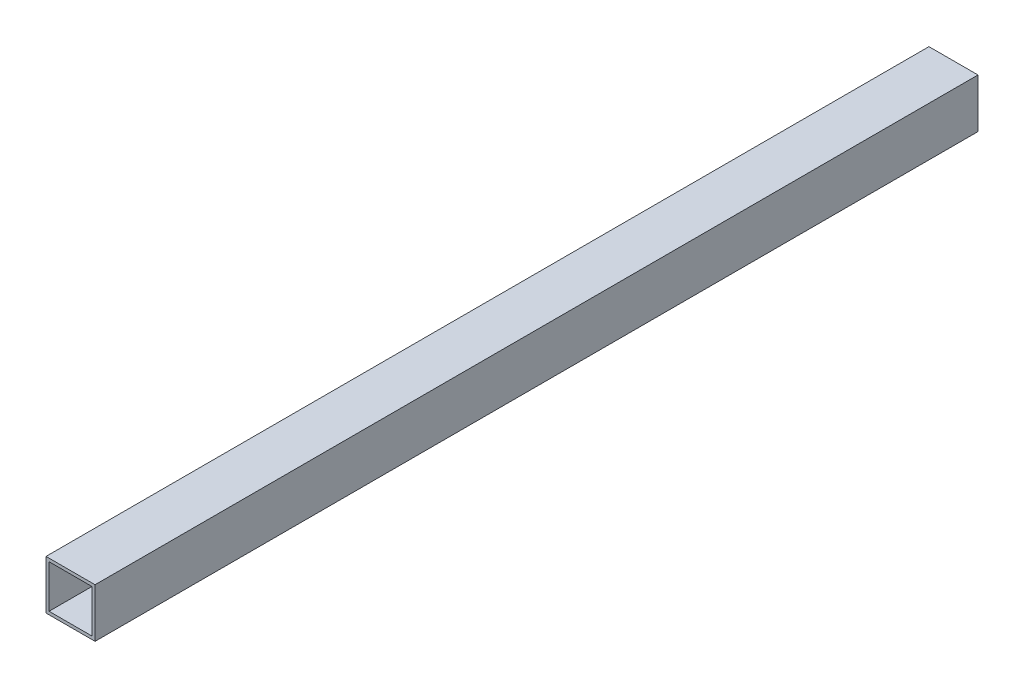
from build123d import *

# Parameters (mm, degrees)
SKETCH1_W           = 50.8
SKETCH1_H           = 50.8
SKETCH1_W_2         = 44.45
SKETCH1_H_2         = 44.45
BOSS_EXTRUDE1_DEPTH = 914.4


with BuildPart() as part:
    # Sketch1 → Boss-Extrude1 (new body)
    with BuildSketch(Plane.XY):
        Rectangle(SKETCH1_W, SKETCH1_H)
        Rectangle(SKETCH1_W_2, SKETCH1_H_2, mode=Mode.SUBTRACT)
    extrude(amount=BOSS_EXTRUDE1_DEPTH)


solid = part.part
